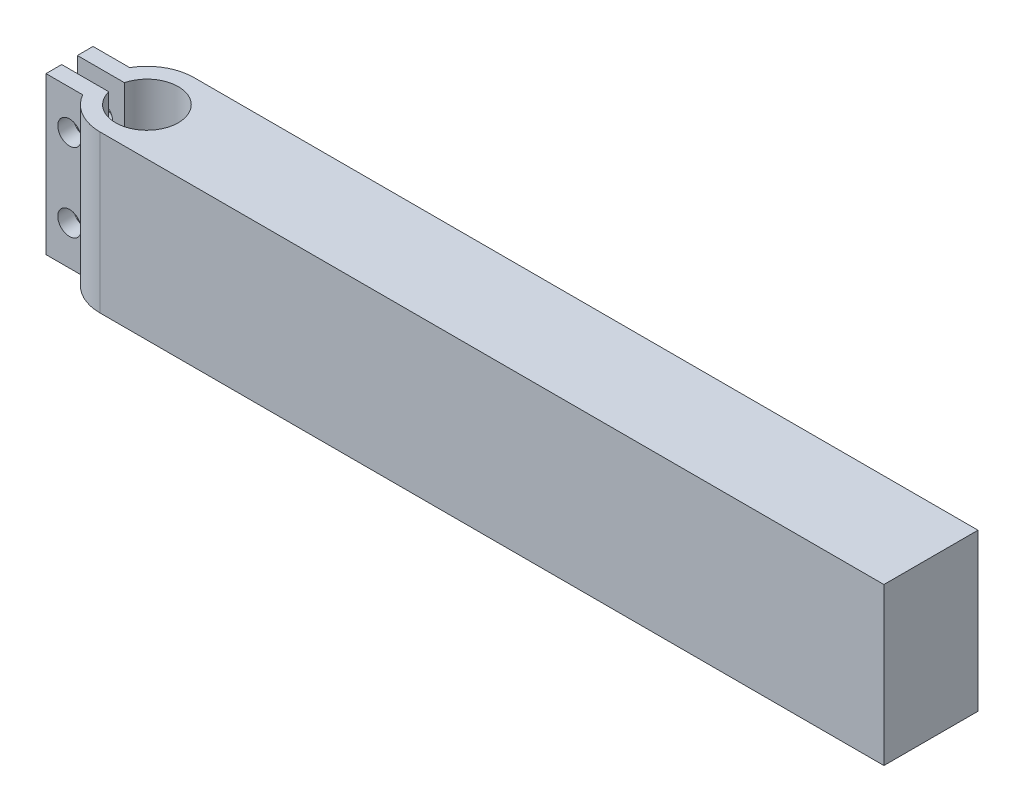
from build123d import *

# Parameters (mm, degrees)
ESBO_O1_R                = 6
ESBO_O1_W                = 100
ESBO_O1_H                = 12
RESSALTO_EXTRUS_O1_DEPTH = 20
ESBO_O2_R                = 4
CORTE_EXTRUS_O1_DEPTH    = 20
ESBO_O3_W                = 10
ESBO_O3_H                = 2
CORTE_EXTRUS_O2_DEPTH    = 20
ESBO_O4_W                = 6
ESBO_O4_H                = 2
RESSALTO_EXTRUS_O2_DEPTH = 20
ESBO_O5_R                = 1.5
CORTE_EXTRUS_O3_DEPTH    = 20


with BuildPart() as part:
    # Esboço1 → Ressalto-extrusão1 (new body)
    with BuildSketch(Plane(origin=(0, 0, 0), x_dir=(1, 0, 0), z_dir=(0, 1, 0))):
        with Locations((0, 6)):
            Circle(ESBO_O1_R)
        with Locations((50, 6)):
            Rectangle(ESBO_O1_W, ESBO_O1_H)
    extrude(amount=RESSALTO_EXTRUS_O1_DEPTH)

    # Esboço2 → Corte-extrusão1 (cut)
    with BuildSketch(Plane(origin=(0, 20, 0), x_dir=(1, 0, 0), z_dir=(0, 1, 0))):
        with Locations(Location((0, 6, 0), (0, 0, 270))):
            Circle(ESBO_O2_R)
    extrude(amount=-CORTE_EXTRUS_O1_DEPTH, mode=Mode.SUBTRACT)

    # Esboço3 → Corte-extrusão2 (cut)
    with BuildSketch(Plane(origin=(0, 20, 0), x_dir=(1, 0, 0), z_dir=(0, 1, 0))):
        with Locations((-4, 6)):
            Rectangle(ESBO_O3_W, ESBO_O3_H)
    extrude(amount=-CORTE_EXTRUS_O2_DEPTH, mode=Mode.SUBTRACT)

    # Esboço4 → Ressalto-extrusão2 (add)
    with BuildSketch(Plane(origin=(0, 20, 0), x_dir=(1, 0, 0), z_dir=(0, 1, 0))):
        with Locations((-6.872983346, 8)):
            Rectangle(ESBO_O4_W, ESBO_O4_H)
        with Locations((-6.872983346, 4)):
            Rectangle(ESBO_O4_W, ESBO_O4_H)
    extrude(amount=-RESSALTO_EXTRUS_O2_DEPTH)

    # Esboço5 → Corte-extrusão3 (cut)
    with BuildSketch(Plane.XY.offset(-3)):
        with Locations((-6.872983346, 15)):
            Circle(ESBO_O5_R)
        with Locations((-6.872983346, 5)):
            Circle(ESBO_O5_R)
    extrude(amount=-CORTE_EXTRUS_O3_DEPTH, mode=Mode.SUBTRACT)


solid = part.part
